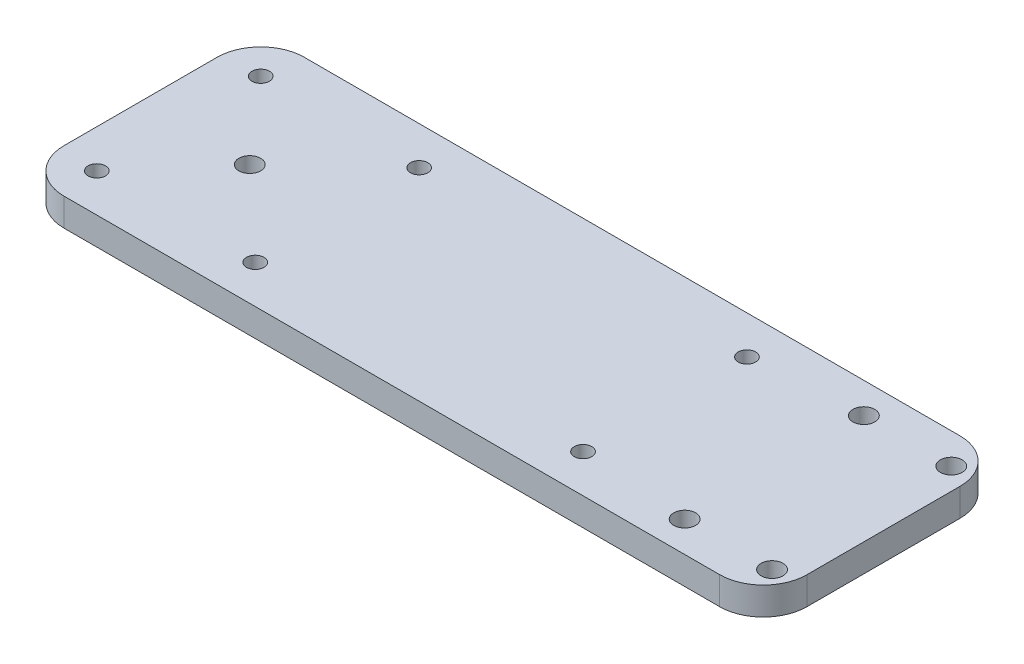
from build123d import *

# Parameters (mm, degrees)
SKETCH1_W                 = 170
SKETCH1_H                 = 55
BOSS_EXTRUDE1_DEPTH       = 6.35
FILLET1_R                 = 10
F_5_0MM_DOWEL_HOLE1_D     = 5
F_4_0MM_DOWEL_HOLE1_D     = 4
F_4_0MM_DOWEL_HOLE1_DEPTH = 6.35
F_5_0MM_DOWEL_HOLE2_D     = 5


with BuildPart() as part:
    # Sketch1 → Boss-Extrude1 (new body)
    with BuildSketch(Plane(origin=(0, 0, 0), x_dir=(1, 0, 0), z_dir=(0, 1, 0))):
        with Locations((60, 0)):
            Rectangle(SKETCH1_W, SKETCH1_H)
    extrude(amount=BOSS_EXTRUDE1_DEPTH)

    # Fillet1
    fillet1_edges = [part.edges().sort_by_distance(p)[0] for p in [
        (-25, 3.175, -27.5),
        (145, 3.175, -27.5),
        (145, 3.175, 27.5),
        (-25, 3.175, 27.5),
    ]]
    fillet(fillet1_edges, radius=FILLET1_R)

    # Ø5.0mm Dowel Hole1 (through all)
    with Locations(Plane(origin=(0, 6.35, 0), x_dir=(1, 0, 0), z_dir=(0, 1, 0))):
        with Locations((0, 0)):
            Hole(F_5_0MM_DOWEL_HOLE1_D / 2)

    # Ø4.0mm Dowel Hole1
    with Locations(Plane(origin=(0, 6.35, 0), x_dir=(1, 0, 0), z_dir=(0, 1, 0))):
        with Locations((-16.25, -18.75), (20, -18.75), (95, -18.75), (170, -18.75), (170, 18.75), (95, 18.75), (20, 18.75), (-16.25, 18.75)):
            Hole(F_4_0MM_DOWEL_HOLE1_D / 2, depth=F_4_0MM_DOWEL_HOLE1_DEPTH)

    # Ø5.0mm Dowel Hole2 (through all)
    with Locations(Plane(origin=(0, 6.35, 0), x_dir=(1, 0, 0), z_dir=(0, 1, 0))):
        with Locations((140, 20.5), (120, 20.5), (140, -20.5), (120, -20.5)):
            Hole(F_5_0MM_DOWEL_HOLE2_D / 2)


solid = part.part
